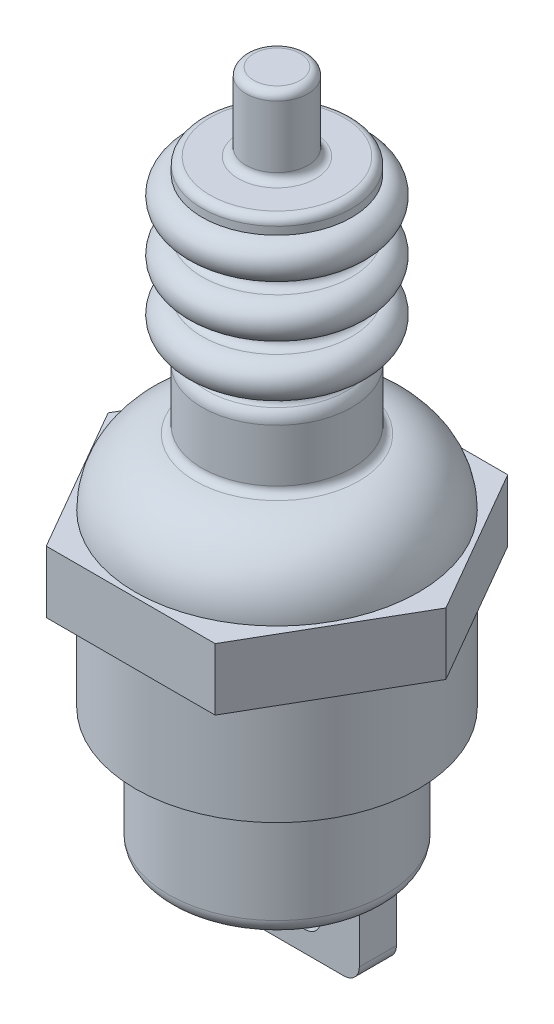
from build123d import *

# Parameters (mm, degrees)
BOSS_EXTRUDE1_DEPTH      = 4
FILLET1_R                = 0.5
BOSS_EXTRUDE2_DEPTH      = 1.2
BOSS_EXTRUDE2_DEPTH_BACK = 1.2


with BuildPart() as part:
    # Sketch1 → Revolve2 (revolve)
    with BuildSketch(Plane.XY, mode=Mode.PRIVATE) as revolve2_sk:
        with BuildLine():
            Line((-4.841290149, 35.511719828), (-4.841290149, 32.110827162))
            ThreePointArc((-4.841290149, 32.110827162), (-4.969810339, 31.776159042), (-5.289301152, 31.613537363))
            ThreePointArc((-5.289301152, 31.613537363), (-8.042487581, 30.212158106), (-9.15, 27.328182451))
            Line((-9.15, 27.328182451), (-9.15, 16.328182451))
            Line((-9.15, 16.328182451), (-7, 16.328182451))
            Line((-7, 16.328182451), (-7, 9.328182451))
            ThreePointArc((-7, 9.328182451), (-6.707106781, 8.62107567), (-6, 8.328182451))
            Line((-6, 8.328182451), (-5, 8.328182451))
            ThreePointArc((-5, 8.328182451), (-4.646446609, 8.47462906), (-4.5, 8.828182451))
            Line((-4.5, 8.828182451), (-4.5, 10.06134659))
            ThreePointArc((-4.5, 10.06134659), (-4.207106781, 10.768453371), (-3.5, 11.06134659))
            Line((-3.5, 11.06134659), (-3.1, 11.06134659))
            ThreePointArc((-3.1, 11.06134659), (-2.392893219, 10.768453371), (-2.1, 10.06134659))
            Line((-2.1, 10.06134659), (-2.1, 8.828182451))
            ThreePointArc((-2.1, 8.828182451), (-1.953553391, 8.47462906), (-1.6, 8.328182451))
            Line((-1.6, 8.328182451), (-1.1, 8.328182451))
            Line((-1.1, 8.328182451), (-1.1, 7.558915529))
            ThreePointArc((-1.1, 7.558915529), (-0.953553391, 7.205362138), (-0.6, 7.058915529))
            Line((-0.6, 7.058915529), (0, 7.058915529))
            Line((0, 7.058915529), (0, 52.136889129))
            Line((0, 52.136889129), (-2, 52.136889129))
            Line((-2, 52.136889129), (-2, 47.136889129))
            Line((-2, 47.136889129), (-4.833323283, 47.136889129))
            Line((-4.833323283, 47.136889129), (-4.833323283, 46.136889129))
            ThreePointArc((-4.833323283, 46.136889129), (-6, 44.970212412), (-4.833323283, 43.803535695))
            ThreePointArc((-4.833323283, 43.803535695), (-4.333323283, 43.303535695), (-4.833323283, 42.803535695))
            ThreePointArc((-4.833323283, 42.803535695), (-6, 41.636858978), (-4.833323283, 40.470182261))
            ThreePointArc((-4.833323283, 40.470182261), (-4.333323283, 39.970182261), (-4.833323283, 39.470182261))
            ThreePointArc((-4.833323283, 39.470182261), (-6, 38.303505544), (-4.833323283, 37.136828827))
            ThreePointArc((-4.833323283, 37.136828827), (-4.365606399, 36.81357983), (-4.502645572, 36.261792494))
            ThreePointArc((-4.502645572, 36.261792494), (-4.752705373, 35.923207724), (-4.841290149, 35.511719828))
        make_face()
    revolve(revolve2_sk.sketch.rotate(Axis((0, 7.058915529, 0), (0, 1, 0)), 180), axis=Axis((0, 7.058915529, 0), (0, 1, 0)))

    # Sketch2 → Boss-Extrude1 (add)
    with BuildSketch(Plane(origin=(0, 23.328182451, 0), x_dir=(-1, 0, 0), z_dir=(0, -1, 0))):
        Polygon((10.911920088, 0), (5.455960044, 9.45), (-5.455960044, 9.45), (-10.911920088, 0), (-5.455960044, -9.45), (5.455960044, -9.45), align=None)
    extrude(amount=-BOSS_EXTRUDE1_DEPTH)

    # Fillet1
    fillet1_edges = [part.edges().sort_by_distance(p)[0] for p in [
        (-4.833323283, 47.136889129, 0),
        (-2, 47.136889129, 0),
        (-2, 52.136889129, 0),
    ]]
    fillet(fillet1_edges, radius=FILLET1_R)

    # Sketch3 → Boss-Extrude2 (add, two sides: drawn at the far end of the back side and taken through both)
    with BuildSketch(Plane.XY.offset(-BOSS_EXTRUDE2_DEPTH_BACK)):
        with BuildLine():
            Line((6.516917269, 5.645914404), (6.516917269, 9.230737522))
            Line((6.516917269, 9.230737522), (4.015126643, 9.230737522))
            Line((4.015126643, 9.230737522), (4.015126643, 6.99168258))
            ThreePointArc((4.015126643, 6.99168258), (3.722233424, 6.284575799), (3.015126643, 5.99168258))
            Line((3.015126643, 5.99168258), (-2.234227104, 5.99168258))
            Line((-2.234227104, 5.99168258), (-2.234227104, 4.645914404))
            Line((-2.234227104, 4.645914404), (5.516917269, 4.645914404))
            ThreePointArc((5.516917269, 4.645914404), (6.22402405, 4.938807623), (6.516917269, 5.645914404))
        make_face()
    extrude(amount=BOSS_EXTRUDE2_DEPTH + BOSS_EXTRUDE2_DEPTH_BACK)


solid = part.part
